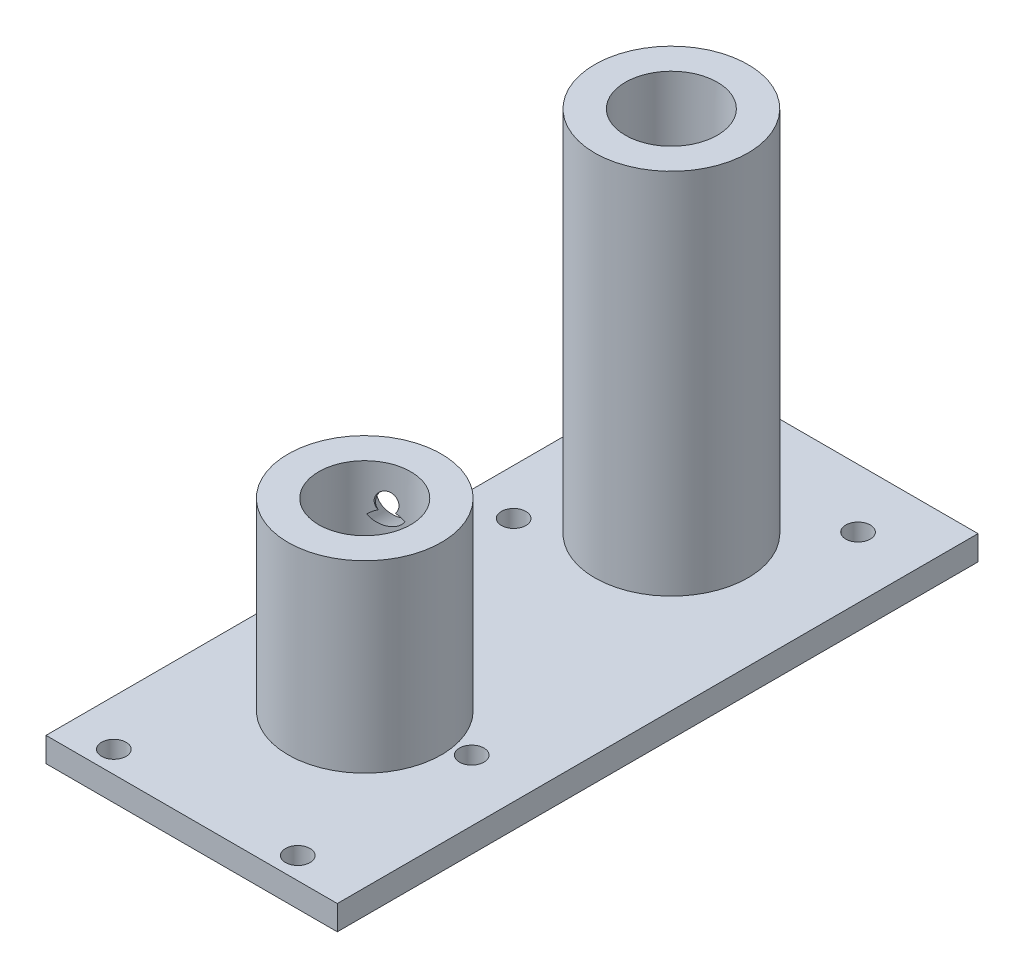
from build123d import *

# Parameters (mm, degrees)
SKETCH1_W                  = 47.5
SKETCH1_H                  = 110
SKETCH1_R                  = 2
SKETCH1_W_2                = 10
SKETCH1_H_2                = 10
BOSS_EXTRUDE1_DEPTH        = 4
SKETCH2_R                  = 12.5
SKETCH2_R_2                = 7.5
BOSS_EXTRUDE2_DEPTH        = 30
SKETCH4_R                  = 12.5
SKETCH4_R_2                = 7.5
BOSS_EXTRUDE3_DEPTH        = 60
SZKIC1_W                   = 47.5
SZKIC1_H                   = 5.522276491
WYTNIJ_WYCI_GNI_CIE1_DEPTH = 10.5
SZYK_LINIOWY1_COUNT        = 2
SZYK_LINIOWY1_PITCH        = 50


with BuildPart() as part:
    # Sketch1 → Boss-Extrude1 (new body)
    with BuildSketch(Plane(origin=(0, 0, 0), x_dir=(1, 0, 0), z_dir=(0, 1, 0))):
        with Locations((-12.897727273, -28.125)):
            Rectangle(SKETCH1_W, SKETCH1_H)
        with Locations(Location((0.852272727, 17.315, 0), (0, 0, 270))):
            Circle(SKETCH1_R, mode=Mode.SUBTRACT)
        with Locations(Location((-29.147727273, -8.845, 0), (0, 0, 270))):
            Circle(SKETCH1_R, mode=Mode.SUBTRACT)
        with Locations(Location((0.852272727, -45.685, 0), (0, 0, 270))):
            Circle(SKETCH1_R, mode=Mode.SUBTRACT)
        with Locations(Location((0.852272727, -74.045, 0), (0, 0, 270))):
            Circle(SKETCH1_R, mode=Mode.SUBTRACT)
        with Locations(Location((-29.147727273, -74.045, 0), (0, 0, 270))):
            Circle(SKETCH1_R, mode=Mode.SUBTRACT)
        with Locations((-14.147727273, 1.875)):
            Rectangle(SKETCH1_W_2, SKETCH1_H_2, mode=Mode.SUBTRACT)
        with Locations((-14.147727273, -48.125)):
            Rectangle(SKETCH1_W_2, SKETCH1_H_2, mode=Mode.SUBTRACT)
    extrude(amount=-BOSS_EXTRUDE1_DEPTH)

    # Sketch2 → Boss-Extrude2 (add)
    with BuildSketch(Plane(origin=(0, 0, 0), x_dir=(1, 0, 0), z_dir=(0, 1, 0))):
        with Locations(Location((-14.147727273, -48.125, 0), (0, 0, 270))):
            Circle(SKETCH2_R)
        with Locations(Location((-14.147727273, -48.125, 0), (0, 0, 270))):
            Circle(SKETCH2_R_2, mode=Mode.SUBTRACT)
    extrude(amount=BOSS_EXTRUDE2_DEPTH)

    # Sketch4 → Boss-Extrude3 (add)
    with BuildSketch(Plane(origin=(0, 0, 0), x_dir=(1, 0, 0), z_dir=(0, 1, 0))):
        with Locations(Location((-14.147727273, 1.875, 0), (0, 0, 270))):
            Circle(SKETCH4_R)
        with Locations(Location((-14.147727273, 1.875, 0), (0, 0, 270))):
            Circle(SKETCH4_R_2, mode=Mode.SUBTRACT)
    extrude(amount=BOSS_EXTRUDE3_DEPTH)

    # Szkic1 → Wytnij-wyciągnięcie1 (cut)
    with BuildSketch(Plane(origin=(0, 0, 0), x_dir=(1, 0, 0), z_dir=(0, 1, 0))):
        with Locations((-12.897727273, -80.363861754)):
            Rectangle(SZKIC1_W, SZKIC1_H)
    extrude(amount=-WYTNIJ_WYCI_GNI_CIE1_DEPTH, mode=Mode.SUBTRACT)

    # Szkic3 → Wycięcie-obrót1 (revolve, cut)
    with BuildSketch(Plane(origin=(-30.053799947, 0, 14.014317072), x_dir=(-0.4226182617407009, 0, -0.9063077870366493), z_dir=(0.9063077870366493, 0, -0.4226182617407009)), mode=Mode.PRIVATE) as wyci_cie_obr_t1_sk:
        Polygon((-31.038274345, 24.733727238), (-30.433976709, 26.129177698), (-29.168033578, 25.580963009), (-28.580169258, 26.938465486), (-22.156612406, 24.156754256), (-23.348774361, 21.40380132), align=None)
    wyci_cie_obr_t1 = revolve(wyci_cie_obr_t1_sk.sketch.rotate(Axis((-15.574618004, 26.129177698, 45.065022951), (-0.3878160615913765, -0.3973873185023342, -0.8316742279674645)), 190.498100282), axis=Axis((-15.574618004, 26.129177698, 45.065022951), (-0.3878160615913765, -0.3973873185023342, -0.8316742279674645)), mode=Mode.SUBTRACT)

    # Szyk liniowy1: Wycięcie-obrót1 ×2
    with Locations(*[(0, 0, -i * SZYK_LINIOWY1_PITCH) for i in range(1, SZYK_LINIOWY1_COUNT)]):
        add(wyci_cie_obr_t1, mode=Mode.SUBTRACT)


solid = part.part
